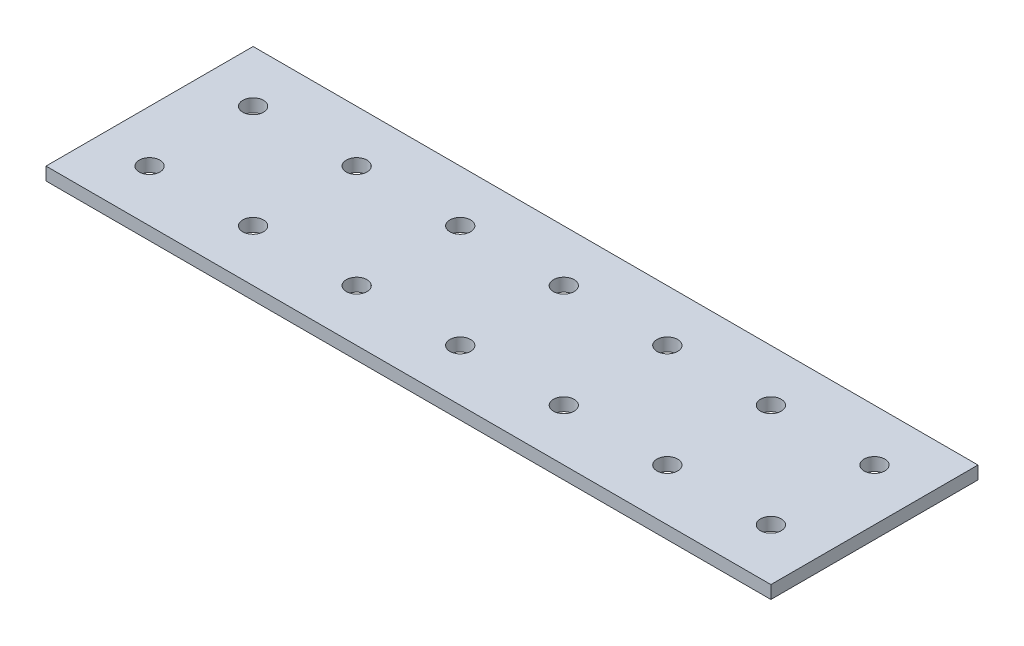
from build123d import *

# Parameters (mm, degrees)
SKETCH2_W           = 177.8
SKETCH2_H           = 50.8
SKETCH2_R           = 2.54
BOSS_EXTRUDE1_DEPTH = 3.175


with BuildPart() as part:
    # Sketch2 → Boss-Extrude1 (new body)
    with BuildSketch(Plane(origin=(0, 0, 0), x_dir=(1, 0, 0), z_dir=(0, 1, 0))):
        Rectangle(SKETCH2_W, SKETCH2_H)
        with Locations(Location((-76.2, -12.7, 0), (0, 0, 270))):
            Circle(SKETCH2_R, mode=Mode.SUBTRACT)
        with Locations(Location((-76.2, 12.7, 0), (0, 0, 270))):
            Circle(SKETCH2_R, mode=Mode.SUBTRACT)
        with Locations(Location((-50.8, -12.7, 0), (0, 0, 270))):
            Circle(SKETCH2_R, mode=Mode.SUBTRACT)
        with Locations(Location((-50.8, 12.7, 0), (0, 0, 270))):
            Circle(SKETCH2_R, mode=Mode.SUBTRACT)
        with Locations(Location((-25.4, -12.7, 0), (0, 0, 270))):
            Circle(SKETCH2_R, mode=Mode.SUBTRACT)
        with Locations(Location((-25.4, 12.7, 0), (0, 0, 270))):
            Circle(SKETCH2_R, mode=Mode.SUBTRACT)
        with Locations(Location((0, -12.7, 0), (0, 0, 270))):
            Circle(SKETCH2_R, mode=Mode.SUBTRACT)
        with Locations(Location((0, 12.7, 0), (0, 0, 270))):
            Circle(SKETCH2_R, mode=Mode.SUBTRACT)
        with Locations(Location((25.4, -12.7, 0), (0, 0, 270))):
            Circle(SKETCH2_R, mode=Mode.SUBTRACT)
        with Locations(Location((25.4, 12.7, 0), (0, 0, 270))):
            Circle(SKETCH2_R, mode=Mode.SUBTRACT)
        with Locations(Location((50.8, -12.7, 0), (0, 0, 270))):
            Circle(SKETCH2_R, mode=Mode.SUBTRACT)
        with Locations(Location((50.8, 12.7, 0), (0, 0, 270))):
            Circle(SKETCH2_R, mode=Mode.SUBTRACT)
        with Locations(Location((76.2, -12.7, 0), (0, 0, 270))):
            Circle(SKETCH2_R, mode=Mode.SUBTRACT)
        with Locations(Location((76.2, 12.7, 0), (0, 0, 270))):
            Circle(SKETCH2_R, mode=Mode.SUBTRACT)
    extrude(amount=BOSS_EXTRUDE1_DEPTH)


solid = part.part
